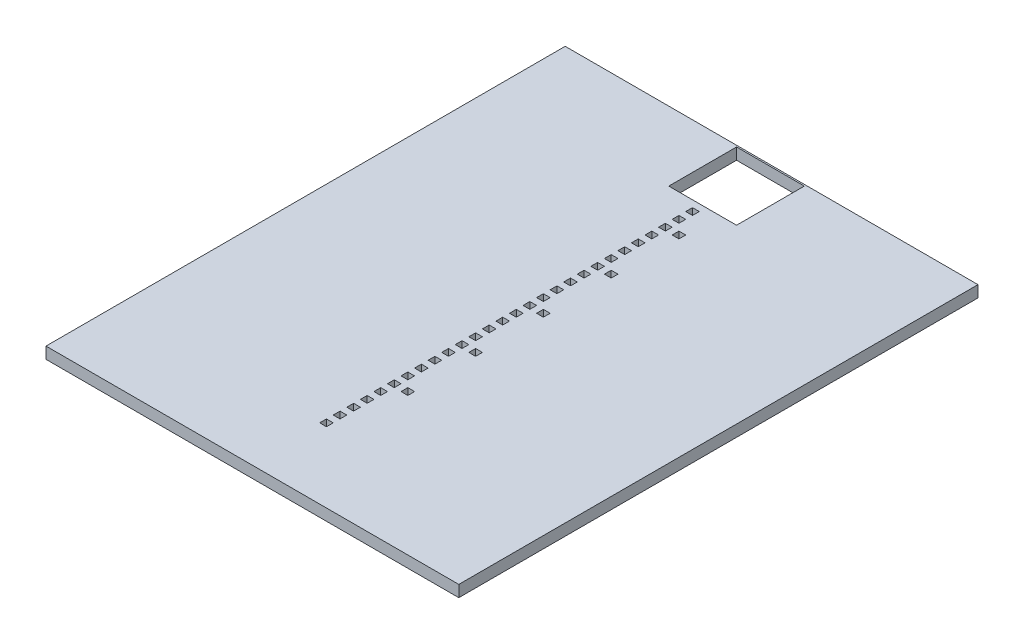
from build123d import *

# Parameters (mm, degrees)
SKETCH1_W           = 609
SKETCH1_H           = 766
SKETCH1_W_2         = 10
SKETCH1_H_2         = 10
SKETCH1_W_3         = 100
SKETCH1_H_3         = 100
BOSS_EXTRUDE1_DEPTH = 17


with BuildPart() as part:
    # Sketch1 → Boss-Extrude1 (new body)
    with BuildSketch(Plane(origin=(0, 0, 0), x_dir=(1, 0, 0), z_dir=(0, 1, 0))):
        with Locations((-0.5, -330.79)):
            Rectangle(SKETCH1_W, SKETCH1_H)
        with Locations((0, -85)):
            Rectangle(SKETCH1_W_2, SKETCH1_H_2, mode=Mode.SUBTRACT)
        Rectangle(SKETCH1_W_3, SKETCH1_H_3, mode=Mode.SUBTRACT)
        with Locations((0, -65)):
            Rectangle(SKETCH1_W_2, SKETCH1_H_2, mode=Mode.SUBTRACT)
        with Locations((0, -105)):
            Rectangle(SKETCH1_W_2, SKETCH1_H_2, mode=Mode.SUBTRACT)
        with Locations((0, -125)):
            Rectangle(SKETCH1_W_2, SKETCH1_H_2, mode=Mode.SUBTRACT)
        with Locations((0, -145)):
            Rectangle(SKETCH1_W_2, SKETCH1_H_2, mode=Mode.SUBTRACT)
        with Locations((0, -165)):
            Rectangle(SKETCH1_W_2, SKETCH1_H_2, mode=Mode.SUBTRACT)
        with Locations((0, -185)):
            Rectangle(SKETCH1_W_2, SKETCH1_H_2, mode=Mode.SUBTRACT)
        with Locations((0, -205)):
            Rectangle(SKETCH1_W_2, SKETCH1_H_2, mode=Mode.SUBTRACT)
        with Locations((0, -225)):
            Rectangle(SKETCH1_W_2, SKETCH1_H_2, mode=Mode.SUBTRACT)
        with Locations((0, -245)):
            Rectangle(SKETCH1_W_2, SKETCH1_H_2, mode=Mode.SUBTRACT)
        with Locations((0, -265)):
            Rectangle(SKETCH1_W_2, SKETCH1_H_2, mode=Mode.SUBTRACT)
        with Locations((0, -285)):
            Rectangle(SKETCH1_W_2, SKETCH1_H_2, mode=Mode.SUBTRACT)
        with Locations((0, -305)):
            Rectangle(SKETCH1_W_2, SKETCH1_H_2, mode=Mode.SUBTRACT)
        with Locations((0, -325)):
            Rectangle(SKETCH1_W_2, SKETCH1_H_2, mode=Mode.SUBTRACT)
        with Locations((0, -345)):
            Rectangle(SKETCH1_W_2, SKETCH1_H_2, mode=Mode.SUBTRACT)
        with Locations((0, -365)):
            Rectangle(SKETCH1_W_2, SKETCH1_H_2, mode=Mode.SUBTRACT)
        with Locations((0, -385)):
            Rectangle(SKETCH1_W_2, SKETCH1_H_2, mode=Mode.SUBTRACT)
        with Locations((0, -405)):
            Rectangle(SKETCH1_W_2, SKETCH1_H_2, mode=Mode.SUBTRACT)
        with Locations((0, -425)):
            Rectangle(SKETCH1_W_2, SKETCH1_H_2, mode=Mode.SUBTRACT)
        with Locations((0, -445)):
            Rectangle(SKETCH1_W_2, SKETCH1_H_2, mode=Mode.SUBTRACT)
        with Locations((0, -465)):
            Rectangle(SKETCH1_W_2, SKETCH1_H_2, mode=Mode.SUBTRACT)
        with Locations((0, -485)):
            Rectangle(SKETCH1_W_2, SKETCH1_H_2, mode=Mode.SUBTRACT)
        with Locations((0, -505)):
            Rectangle(SKETCH1_W_2, SKETCH1_H_2, mode=Mode.SUBTRACT)
        with Locations((0, -525)):
            Rectangle(SKETCH1_W_2, SKETCH1_H_2, mode=Mode.SUBTRACT)
        with Locations((0, -545)):
            Rectangle(SKETCH1_W_2, SKETCH1_H_2, mode=Mode.SUBTRACT)
        with Locations((0, -565)):
            Rectangle(SKETCH1_W_2, SKETCH1_H_2, mode=Mode.SUBTRACT)
        with Locations((0, -585)):
            Rectangle(SKETCH1_W_2, SKETCH1_H_2, mode=Mode.SUBTRACT)
        with Locations((0, -605)):
            Rectangle(SKETCH1_W_2, SKETCH1_H_2, mode=Mode.SUBTRACT)
        with Locations((20, -105)):
            Rectangle(SKETCH1_W_2, SKETCH1_H_2, mode=Mode.SUBTRACT)
        with Locations((20, -205)):
            Rectangle(SKETCH1_W_2, SKETCH1_H_2, mode=Mode.SUBTRACT)
        with Locations((20, -305)):
            Rectangle(SKETCH1_W_2, SKETCH1_H_2, mode=Mode.SUBTRACT)
        with Locations((20, -405)):
            Rectangle(SKETCH1_W_2, SKETCH1_H_2, mode=Mode.SUBTRACT)
        with Locations((20, -505)):
            Rectangle(SKETCH1_W_2, SKETCH1_H_2, mode=Mode.SUBTRACT)
    extrude(amount=BOSS_EXTRUDE1_DEPTH)


solid = part.part
